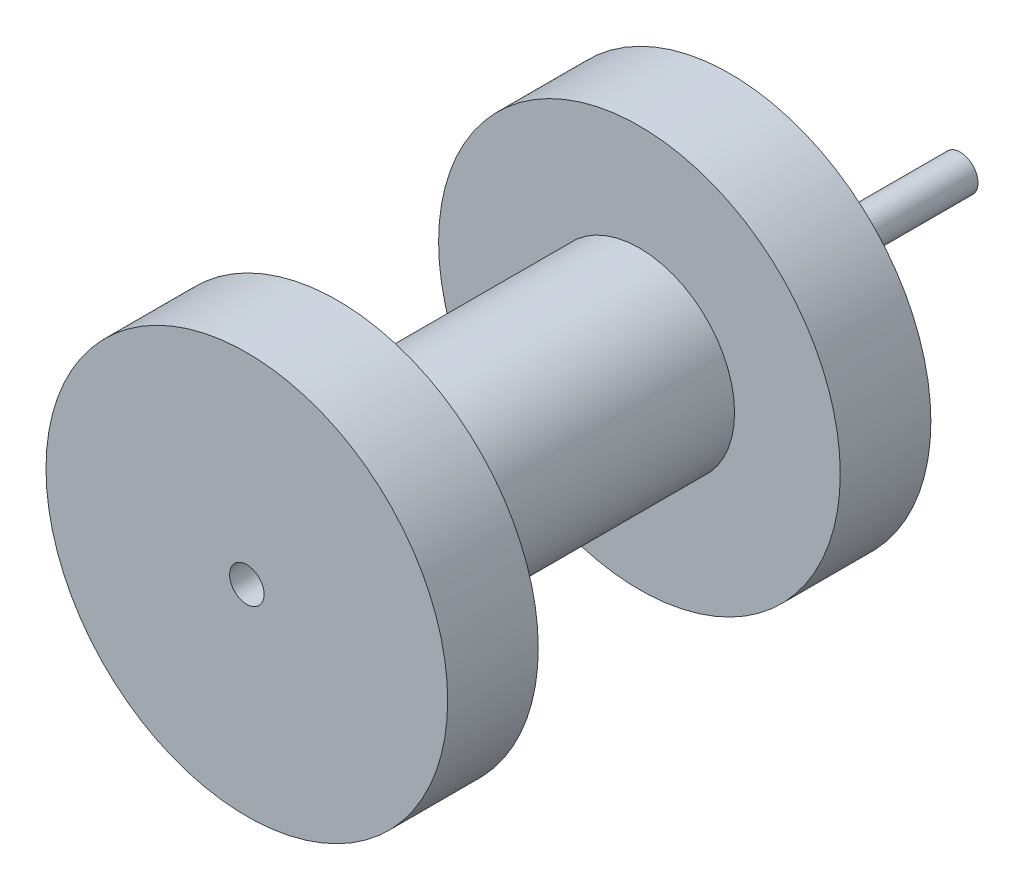
from build123d import *

# Parameters (mm, degrees)
SKETCH1_R            = 1.500124
BOSS_EXTRUDE1_DEPTH  = 29.9974
SHELL3_T             = -0.0508
SKETCH5_R            = 16.891
SKETCH5_R_2          = 1.449324
BOSS_EXTRUDE8_DEPTH  = 7.62
SKETCH6_R            = 7.9999967
SKETCH6_R_2          = 7.62
BOSS_EXTRUDE9_DEPTH  = 25.4
SKETCH7_R            = 16.891
SKETCH7_R_2          = 1.500124
BOSS_EXTRUDE10_DEPTH = 7.62
SKETCH8_R            = 7.9999967
SKETCH8_R_2          = 1.449324
BOSS_EXTRUDE11_DEPTH = 2.54


with BuildPart() as part:
    # Sketch1 → Boss-Extrude1 (new, symmetric)
    with BuildSketch(Plane.XY):
        Circle(SKETCH1_R)
    extrude(amount=BOSS_EXTRUDE1_DEPTH, both=True)

    # Shell3
    shell3_openings = [part.faces().sort_by_distance(p)[0] for p in [
        (0, 0, 29.9974),
        (0, 0, -29.9974),
    ]]
    offset(amount=SHELL3_T, openings=shell3_openings, kind=Kind.INTERSECTION)

    # Sketch5 → Boss-Extrude8 (add)
    with BuildSketch(Plane.XY.offset(29.9974)):
        Circle(SKETCH5_R)
        Circle(SKETCH5_R_2, mode=Mode.SUBTRACT)
    extrude(amount=-BOSS_EXTRUDE8_DEPTH)

    # Sketch6 → Boss-Extrude9 (add)
    with BuildSketch(Plane(origin=(0, 0, 22.3774), x_dir=(-1, 0, 0), z_dir=(0, 0, -1))):
        with Locations(Location((0, 0, 0), (0, 0, 180))):
            Circle(SKETCH6_R)
        Circle(SKETCH6_R_2, mode=Mode.SUBTRACT)
    extrude(amount=BOSS_EXTRUDE9_DEPTH)

    # Sketch7 → Boss-Extrude10 (add)
    with BuildSketch(Plane(origin=(0, 0, -3.0226), x_dir=(-1, 0, 0), z_dir=(0, 0, -1))):
        with Locations(Location((0, 0, 0), (0, 0, 180))):
            Circle(SKETCH7_R)
        Circle(SKETCH7_R_2, mode=Mode.SUBTRACT)
    extrude(amount=BOSS_EXTRUDE10_DEPTH)

    # Sketch8 → Boss-Extrude11 (add)
    with BuildSketch(Plane.XY.offset(29.9974)):
        Circle(SKETCH8_R)
        Circle(SKETCH8_R_2, mode=Mode.SUBTRACT)
    extrude(amount=-BOSS_EXTRUDE11_DEPTH)


solid = part.part
